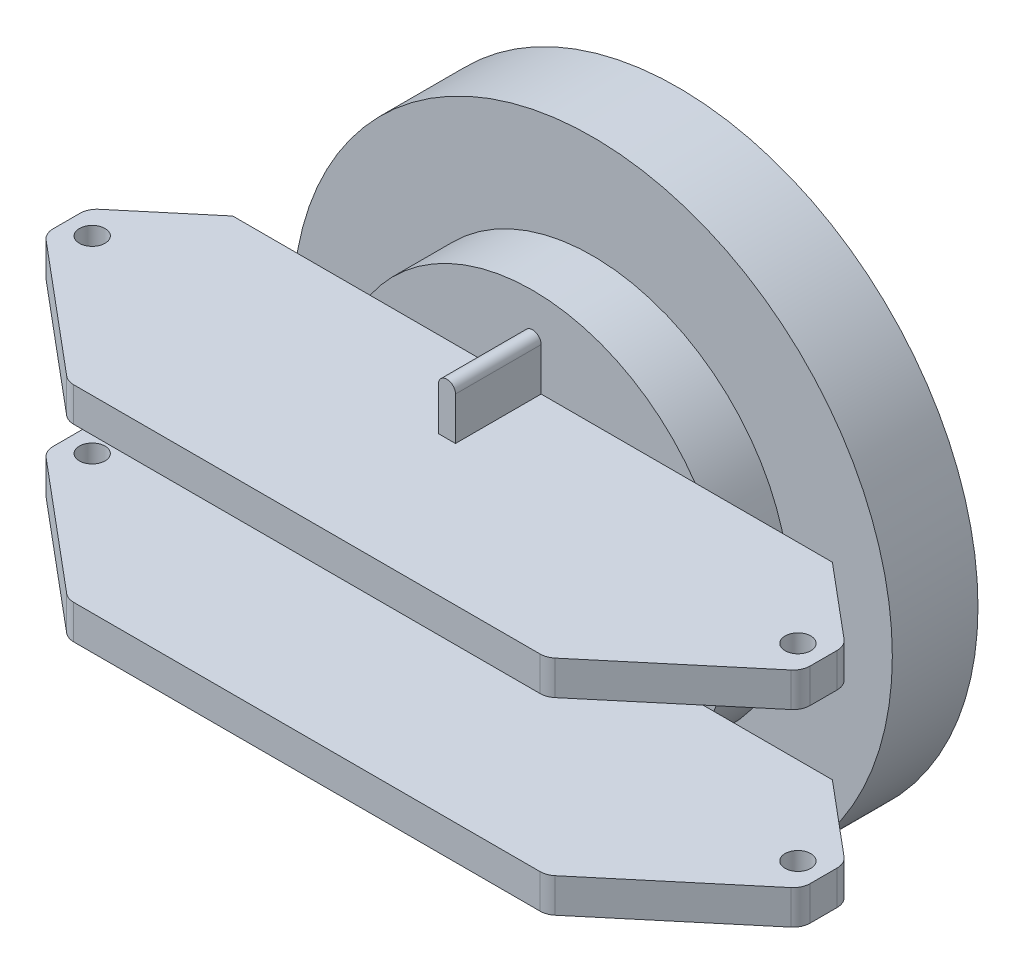
from build123d import *

# Parameters (mm, degrees)
SKETCH1_R                   = 35
BOSS_EXTRUDE1_DEPTH         = 10
SKETCH2_R                   = 23
BOSS_EXTRUDE2_DEPTH         = 7
BOSS_EXTRUDE3_DEPTH         = 4
SKETCH4_R                   = 1.5
CUT_EXTRUDE1_DEPTH          = 4
FILLET1_R                   = 2
FILLET1_OF_MIRROR1_R        = 2
SKETCH7_W                   = 2
SKETCH7_H                   = 6
BOSS_EXTRUDE4_DEPTH         = 10
FILLET2_RADIUS              = 1
FILLET2_LENGTH              = 10
FILLET2_OF_MIRROR2_2_RADIUS = 1
FILLET2_OF_MIRROR2_2_LENGTH = 10
SKETCH8_R                   = 15
CUT_EXTRUDE2_DEPTH          = 10


with BuildPart() as part:
    # Sketch1 → Boss-Extrude1 (new body)
    with BuildSketch(Plane.XY):
        Circle(SKETCH1_R)
    extrude(amount=BOSS_EXTRUDE1_DEPTH)

    # Sketch2 → Boss-Extrude2 (add)
    with BuildSketch(Plane.XY.offset(10)):
        Circle(SKETCH2_R)
    extrude(amount=BOSS_EXTRUDE2_DEPTH)

    # Sketch3 → Boss-Extrude3 (add)
    with BuildSketch(Plane(origin=(0, 13, 0), x_dir=(1, 0, 0), z_dir=(0, 1, 0))):
        Polygon((-27.952, -43.343338219), (27.952, -43.343338219), (44.194, -29.714682009), (44.194, -24.714682009), (35, -17), (-35, -17), (-44.194, -24.714682009), (-44.194, -29.714682009), align=None)
    boss_extrude3 = extrude(amount=-BOSS_EXTRUDE3_DEPTH)

    # Sketch4 → Cut-Extrude1 (cut)
    with BuildSketch(Plane(origin=(0, 13, 0), x_dir=(1, 0, 0), z_dir=(0, 1, 0))):
        with Locations(Location((-41.194, -27.214682009, 0), (0, 0, 270))):
            Circle(SKETCH4_R)
        with Locations(Location((41.194, -27.214682009, 0), (0, 0, 90))):
            Circle(SKETCH4_R)
    cut_extrude1 = extrude(amount=-CUT_EXTRUDE1_DEPTH, mode=Mode.SUBTRACT)

    # Fillet1
    fillet1_edges = [part.edges().sort_by_distance(p)[0] for p in [
        (44.194, 11, 24.714682009),
        (44.194, 11, 29.714682009),
        (27.952, 11, 43.343338219),
        (-27.952, 11, 43.343338219),
        (-44.194, 11, 29.714682009),
        (-44.194, 11, 24.714682009),
    ]]
    fillet(fillet1_edges, radius=FILLET1_R)

    # Mirror1: Boss-Extrude3, Cut-Extrude1 across plane
    add(boss_extrude3.mirror(Plane.ZX))
    add(cut_extrude1.mirror(Plane.ZX), mode=Mode.SUBTRACT)

    # Fillet1 of Mirror1
    fillet1_of_mirror1_edges = [part.edges().sort_by_distance(p)[0] for p in [
        (44.194, -11, 24.714682009),
        (44.194, -11, 29.714682009),
        (27.952, -11, 43.343338219),
        (-27.952, -11, 43.343338219),
        (-44.194, -11, 29.714682009),
        (-44.194, -11, 24.714682009),
    ]]
    fillet(fillet1_of_mirror1_edges, radius=FILLET1_OF_MIRROR1_R)

    # Sketch7 → Boss-Extrude4 (add)
    with BuildSketch(Plane.XY.offset(17)):
        with Locations((0, 16)):
            Rectangle(SKETCH7_W, SKETCH7_H)
    boss_extrude4 = extrude(amount=BOSS_EXTRUDE4_DEPTH)

    # Fillet2: full round fillet: the end face becomes a half cylinder, R = half its width
    fillet2_face = Plane((0, 19, 22), x_dir=(0, 0, 1), z_dir=(0, 1, 0))  # on the end face: x along it, z out of the body
    fillet2_slab = fillet2_face.offset(-FILLET2_RADIUS / 2) * Box(FILLET2_LENGTH, 2 * FILLET2_RADIUS, FILLET2_RADIUS, mode=Mode.PRIVATE)  # the body's end, R deep
    fillet2_round = Plane((0, 18, 22), x_dir=(0, 1, 0), z_dir=(0, 0, 1)) * Cylinder(FILLET2_RADIUS, FILLET2_LENGTH, mode=Mode.PRIVATE)  # its axis R under the face
    add(fillet2_slab - fillet2_round, mode=Mode.SUBTRACT)

    # Mirror2: Boss-Extrude4 across plane
    add(boss_extrude4.mirror(Plane.ZX))

    # Fillet2 of Mirror2 2: full round fillet: the end face becomes a half cylinder, R = half its width
    fillet2_of_mirror2_2_face = Plane((0, -19, 22), x_dir=(0, 0, 1), z_dir=(0, -1, 0))  # on the end face: x along it, z out of the body
    fillet2_of_mirror2_2_slab = fillet2_of_mirror2_2_face.offset(-FILLET2_OF_MIRROR2_2_RADIUS / 2) * Box(FILLET2_OF_MIRROR2_2_LENGTH, 2 * FILLET2_OF_MIRROR2_2_RADIUS, FILLET2_OF_MIRROR2_2_RADIUS, mode=Mode.PRIVATE)  # the body's end, R deep
    fillet2_of_mirror2_2_round = Plane((0, -18, 22), x_dir=(0, -1, 0), z_dir=(0, 0, 1)) * Cylinder(FILLET2_OF_MIRROR2_2_RADIUS, FILLET2_OF_MIRROR2_2_LENGTH, mode=Mode.PRIVATE)  # its axis R under the face
    add(fillet2_of_mirror2_2_slab - fillet2_of_mirror2_2_round, mode=Mode.SUBTRACT)

    # Sketch8 → Cut-Extrude2 (cut)
    with BuildSketch(Plane(origin=(0, 0, 0), x_dir=(-1, 0, 0), z_dir=(0, 0, -1))):
        Circle(SKETCH8_R)
    extrude(amount=-CUT_EXTRUDE2_DEPTH, mode=Mode.SUBTRACT)


solid = part.part
